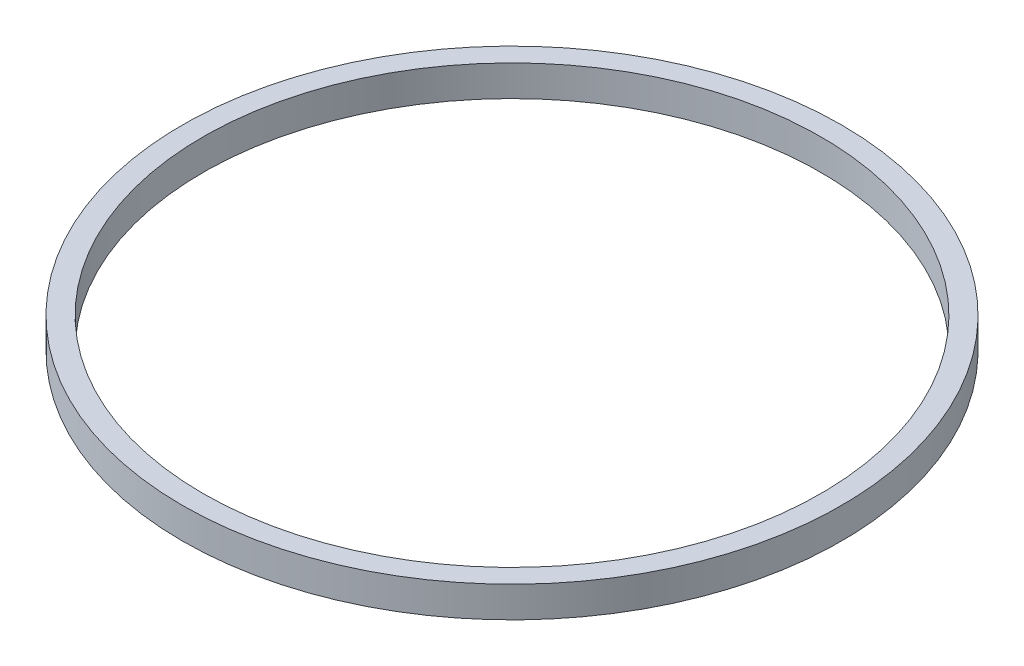
from build123d import *

# Parameters (mm, degrees)
SKETCH2_R           = 32
SKETCH2_R_2         = 30
BOSS_EXTRUDE1_DEPTH = 3


with BuildPart() as part:
    # Sketch2 → Boss-Extrude1 (new body)
    with BuildSketch(Plane(origin=(0, 0, 0), x_dir=(1, 0, 0), z_dir=(0, 1, 0))):
        with Locations(Location((0, 0, 0), (0, 0, 270))):
            Circle(SKETCH2_R)
        with Locations(Location((0, 0, 0), (0, 0, 270))):
            Circle(SKETCH2_R_2, mode=Mode.SUBTRACT)
    extrude(amount=BOSS_EXTRUDE1_DEPTH)


solid = part.part
